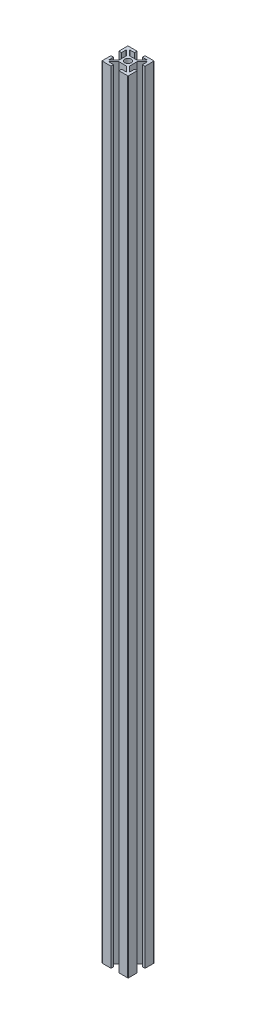
from build123d import *

# Parameters (mm, degrees)
SKETCH1_R           = 2.5
BOSS_EXTRUDE2_DEPTH = 600


with BuildPart() as part:
    # Sketch1 → Boss-Extrude2 (new body)
    with BuildSketch(Plane(origin=(0, 0, 0), x_dir=(1, 0, 0), z_dir=(0, 1, 0))):
        with BuildLine():
            Line((-9.896296296, 3), (-8.196296296, 3))
            ThreePointArc((-8.196296296, 3), (-8.090230279, 3.043933983), (-8.046296296, 3.15))
            Line((-8.046296296, 3.15), (-8.046296296, 6.586184513))
            ThreePointArc((-8.046296296, 6.586184513), (-7.954097251, 6.724600732), (-7.790842301, 6.692859041))
            Line((-7.790842301, 6.692859041), (-4, 2.945390222))
            Line((-4, 2.945390222), (-4, -2.945390222))
            Line((-4, -2.945390222), (-7.790842301, -6.692859041))
            ThreePointArc((-7.790842301, -6.692859041), (-7.954097251, -6.724600732), (-8.046296296, -6.586184513))
            Line((-8.046296296, -6.586184513), (-8.046296296, -3.15))
            ThreePointArc((-8.046296296, -3.15), (-8.090230279, -3.043933983), (-8.196296296, -3))
            Line((-8.196296296, -3), (-9.896296296, -3))
            ThreePointArc((-9.896296296, -3), (-10.002362313, -3.043933983), (-10.046296296, -3.15))
            Line((-10.046296296, -3.15), (-10.046296296, -9.65))
            ThreePointArc((-10.046296296, -9.65), (-9.94378367, -9.897487373), (-9.696296296, -10))
            Line((-9.696296296, -10), (-3.196296296, -10))
            ThreePointArc((-3.196296296, -10), (-3.090230279, -9.956066017), (-3.046296296, -9.85))
            Line((-3.046296296, -9.85), (-3.046296296, -8.15))
            ThreePointArc((-3.046296296, -8.15), (-3.090230279, -8.043933983), (-3.196296296, -8))
            Line((-3.196296296, -8), (-6.614381093, -8))
            ThreePointArc((-6.614381093, -8), (-6.753127587, -7.9070036), (-6.719835089, -7.743325472))
            Line((-6.719835089, -7.743325472), (-2.93318409, -4))
            Line((-2.93318409, -4), (2.93318409, -4))
            Line((2.93318409, -4), (6.719835089, -7.743325472))
            ThreePointArc((6.719835089, -7.743325472), (6.753127587, -7.9070036), (6.614381093, -8))
            Line((6.614381093, -8), (3.196296296, -8))
            ThreePointArc((3.196296296, -8), (3.090230279, -8.043933983), (3.046296296, -8.15))
            Line((3.046296296, -8.15), (3.046296296, -9.85))
            ThreePointArc((3.046296296, -9.85), (3.090230279, -9.956066017), (3.196296296, -10))
            Line((3.196296296, -10), (9.696296296, -10))
            ThreePointArc((9.696296296, -10), (9.94378367, -9.897487373), (10.046296296, -9.65))
            Line((10.046296296, -9.65), (10.046296296, -3.15))
            ThreePointArc((10.046296296, -3.15), (10.002362313, -3.043933983), (9.896296296, -3))
            Line((9.896296296, -3), (8.196296296, -3))
            ThreePointArc((8.196296296, -3), (8.090230279, -3.043933983), (8.046296296, -3.15))
            Line((8.046296296, -3.15), (8.046296296, -6.586184513))
            ThreePointArc((8.046296296, -6.586184513), (7.954097251, -6.724600732), (7.790842301, -6.692859041))
            Line((7.790842301, -6.692859041), (4, -2.945390222))
            Line((4, -2.945390222), (4, 2.945390222))
            Line((4, 2.945390222), (7.790842301, 6.692859041))
            ThreePointArc((7.790842301, 6.692859041), (7.954097251, 6.724600732), (8.046296296, 6.586184513))
            Line((8.046296296, 6.586184513), (8.046296296, 3.15))
            ThreePointArc((8.046296296, 3.15), (8.090230279, 3.043933983), (8.196296296, 3))
            Line((8.196296296, 3), (9.896296296, 3))
            ThreePointArc((9.896296296, 3), (10.002362313, 3.043933983), (10.046296296, 3.15))
            Line((10.046296296, 3.15), (10.046296296, 9.65))
            ThreePointArc((10.046296296, 9.65), (9.94378367, 9.897487373), (9.696296296, 10))
            Line((9.696296296, 10), (3.196296296, 10))
            ThreePointArc((3.196296296, 10), (3.090230279, 9.956066017), (3.046296296, 9.85))
            Line((3.046296296, 9.85), (3.046296296, 8.15))
            ThreePointArc((3.046296296, 8.15), (3.090230279, 8.043933983), (3.196296296, 8))
            Line((3.196296296, 8), (6.614381093, 8))
            ThreePointArc((6.614381093, 8), (6.753127587, 7.9070036), (6.719835089, 7.743325472))
            Line((6.719835089, 7.743325472), (2.93318409, 4))
            Line((2.93318409, 4), (-2.93318409, 4))
            Line((-2.93318409, 4), (-6.719835089, 7.743325472))
            ThreePointArc((-6.719835089, 7.743325472), (-6.753127587, 7.9070036), (-6.614381093, 8))
            Line((-6.614381093, 8), (-3.196296296, 8))
            ThreePointArc((-3.196296296, 8), (-3.090230279, 8.043933983), (-3.046296296, 8.15))
            Line((-3.046296296, 8.15), (-3.046296296, 9.85))
            ThreePointArc((-3.046296296, 9.85), (-3.090230279, 9.956066017), (-3.196296296, 10))
            Line((-3.196296296, 10), (-9.696296296, 10))
            ThreePointArc((-9.696296296, 10), (-9.94378367, 9.897487373), (-10.046296296, 9.65))
            Line((-10.046296296, 9.65), (-10.046296296, 3.15))
            ThreePointArc((-10.046296296, 3.15), (-10.002362313, 3.043933983), (-9.896296296, 3))
        make_face()
        with Locations(Location((0, 0, 0), (0, 0, 270))):
            Circle(SKETCH1_R, mode=Mode.SUBTRACT)
    extrude(amount=BOSS_EXTRUDE2_DEPTH)


solid = part.part
